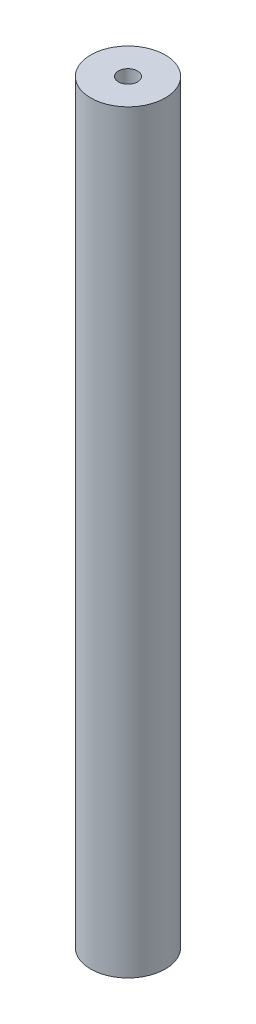
from build123d import *

# Parameters (mm, degrees)
SKETCH2_R           = 8.2
BOSS_EXTRUDE1_DEPTH = 166
SKETCH3_R           = 2.1
CUT_EXTRUDE1_DEPTH  = 10
CUT_EXTRUDE2_START  = -10
SKETCH4_R           = 2.1
CUT_EXTRUDE2_DEPTH  = 10


with BuildPart() as part:
    # Sketch2 → Boss-Extrude1 (new body)
    with BuildSketch(Plane(origin=(0, 0, 0), x_dir=(1, 0, 0), z_dir=(0, 1, 0))):
        with Locations(Location((0, 0, 0), (0, 0, 270))):
            Circle(SKETCH2_R)
    extrude(amount=BOSS_EXTRUDE1_DEPTH)

    # Sketch3 → Cut-Extrude1 (cut)
    with BuildSketch(Plane(origin=(0, 166, 0), x_dir=(1, 0, 0), z_dir=(0, 1, 0))):
        with Locations(Location((0, 0, 0), (0, 0, 270))):
            Circle(SKETCH3_R)
    extrude(amount=-CUT_EXTRUDE1_DEPTH, mode=Mode.SUBTRACT)

    # Sketch4 → Cut-Extrude2 (cut)
    with BuildSketch(Plane.XZ.offset(CUT_EXTRUDE2_START)):
        with Locations(Location((0, 0, 0), (0, 0, 90))):
            Circle(SKETCH4_R)
    extrude(amount=CUT_EXTRUDE2_DEPTH, mode=Mode.SUBTRACT)


solid = part.part
